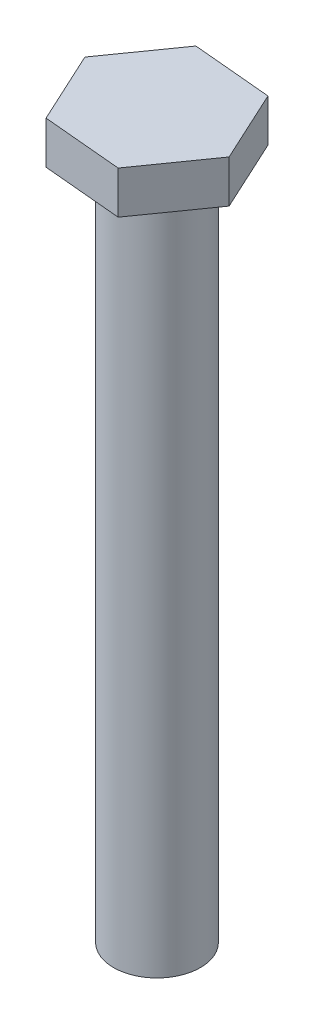
from build123d import *

# Parameters (mm, degrees)
SKETCH2_R           = 2.55
BOSS_EXTRUDE1_DEPTH = 40
BOSS_EXTRUDE2_DEPTH = 2.5


with BuildPart() as part:
    # Sketch2 → Boss-Extrude1 (new body)
    with BuildSketch(Plane(origin=(0, 0, 0), x_dir=(1, 0, 0), z_dir=(0, 1, 0))):
        with Locations(Location((0, 0, 0), (0, 0, 270))):
            Circle(SKETCH2_R)
    extrude(amount=-BOSS_EXTRUDE1_DEPTH)

    # Sketch3 → Boss-Extrude2 (add)
    with BuildSketch(Plane(origin=(0, 0, 0), x_dir=(1, 0, 0), z_dir=(0, 1, 0))):
        Polygon((2.695039823, 3.821879165), (-1.962324536, 4.244912533), (-4.657364359, 0.423033368), (-2.695039823, -3.821879165), (1.962324536, -4.244912533), (4.657364359, -0.423033368), align=None)
    extrude(amount=BOSS_EXTRUDE2_DEPTH)


solid = part.part
